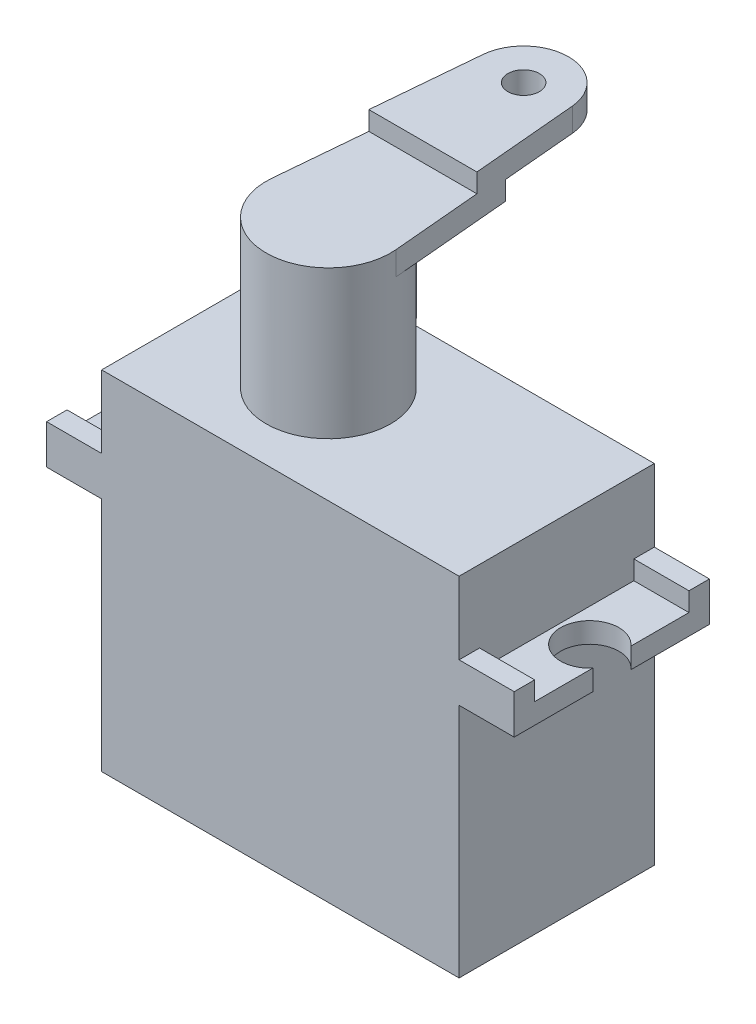
from build123d import *

# Parameters (mm, degrees)
BOSS_EXTRUDE1_DEPTH     = 12.4
CUT_EXTRUDE1_DEPTH      = 1.2
CUT_EXTRUDE2_DEPTH      = 3
SKETCH3_R               = 3.95
TURNBASE_DEPTH          = 7.9
BOSS_EXTRUDE3_DEPTH     = 2.7
CUT_EXTRUDE3_DEPTH      = 26.394586037
CUT_EXTRUDE3_DEPTH_BACK = 26.394586037
SKETCH6_W               = 7.25
SKETCH6_H               = 1.2
SKETCH6_W_2             = 9.95
SKETCH7_R               = 1
CUT_EXTRUDE4_DEPTH      = 38.994374584


with BuildPart() as part:
    # Sketch1 → Boss-Extrude1 (new body)
    with BuildSketch(Plane.XY):
        Polygon((-11.35, -1.25), (-11.35, -16.25), (11.35, -16.25), (11.35, -1.25), (14.85, -1.25), (14.85, 1.25), (11.35, 1.25), (11.35, 5.85), (-11.35, 5.85), (-11.35, 1.25), (-14.85, 1.25), (-14.85, -1.25), align=None)
    extrude(amount=BOSS_EXTRUDE1_DEPTH)

    # Sketch2 → Cut-Extrude1 (cut)
    with BuildSketch(Plane(origin=(0, 1.25, 0), x_dir=(1, 0, 0), z_dir=(0, 1, 0))):
        with BuildLine():
            Line((14.85, -1.3), (11.35, -1.3))
            Line((11.35, -1.3), (11.35, -11.1))
            Line((11.35, -11.1), (14.85, -11.1))
            Line((14.85, -11.1), (14.85, -7.409338662))
            ThreePointArc((14.85, -7.409338662), (11.6, -6.2), (14.85, -4.990661338))
            Line((14.85, -4.990661338), (14.85, -1.3))
        make_face()
    cut_extrude1 = extrude(amount=-CUT_EXTRUDE1_DEPTH, mode=Mode.SUBTRACT)

    # Sketch2<3> → Cut-Extrude2 (cut)
    with BuildSketch(Plane(origin=(0, 1.25, 0), x_dir=(1, 0, 0), z_dir=(0, 1, 0))):
        with BuildLine():
            Line((14.85, -7.409338662), (14.85, -4.990661338))
            ThreePointArc((14.85, -4.990661338), (11.6, -6.2), (14.85, -7.409338662))
        make_face()
    cut_extrude2 = extrude(amount=-CUT_EXTRUDE2_DEPTH, mode=Mode.SUBTRACT)

    # Mirror1: Cut-Extrude1, Cut-Extrude2 across plane
    add(cut_extrude1.mirror(Plane(origin=(0, 0, 0), x_dir=(0, 0, 1), z_dir=(1, 0, 0))), mode=Mode.SUBTRACT)
    add(cut_extrude2.mirror(Plane(origin=(0, 0, 0), x_dir=(0, 0, 1), z_dir=(1, 0, 0))), mode=Mode.SUBTRACT)

    # Sketch3 → TurnBase (add)
    with BuildSketch(Plane(origin=(0, 5.85, 0), x_dir=(1, 0, 0), z_dir=(0, 1, 0))):
        with Locations((-3.15, -6.2)):
            Circle(SKETCH3_R)
    extrude(amount=TURNBASE_DEPTH)

    # Sketch4 → Boss-Extrude3 (add)
    with BuildSketch(Plane(origin=(0, 13.75, 0), x_dir=(1, 0, 0), z_dir=(0, 1, 0))):
        with BuildLine():
            Line((-5.988763946, 6.452822581), (-7.084427224, -5.849596774))
            ThreePointArc((-7.084427224, -5.849596774), (-3.15, -10.15), (0.784427224, -5.849596774))
            Line((0.784427224, -5.849596774), (-0.311236054, 6.452822581))
            ThreePointArc((-0.311236054, 6.452822581), (-3.15, 9.05), (-5.988763946, 6.452822581))
        make_face()
    extrude(amount=BOSS_EXTRUDE3_DEPTH)

    # Sketch6 → Cut-Extrude3 (cut, two sides: drawn at the far end of the back side and taken through both)
    with BuildSketch(Plane(origin=(0, 0, 0), x_dir=(0, 0, -1), z_dir=(1, 0, 0)).offset(-CUT_EXTRUDE3_DEPTH_BACK)):
        with Locations((5.425, 14.35)):
            Rectangle(SKETCH6_W, SKETCH6_H)
        with Locations((-5.175, 15.85)):
            Rectangle(SKETCH6_W_2, SKETCH6_H)
    extrude(amount=CUT_EXTRUDE3_DEPTH + CUT_EXTRUDE3_DEPTH_BACK, mode=Mode.SUBTRACT)

    # Sketch7 → Cut-Extrude4 (cut, through all)
    with BuildSketch(Plane(origin=(0, 16.45, 0), x_dir=(1, 0, 0), z_dir=(0, 1, 0))):
        with Locations((-3.15, 6.2)):
            Circle(SKETCH7_R)
    extrude(amount=-CUT_EXTRUDE4_DEPTH, mode=Mode.SUBTRACT)


solid = part.part
